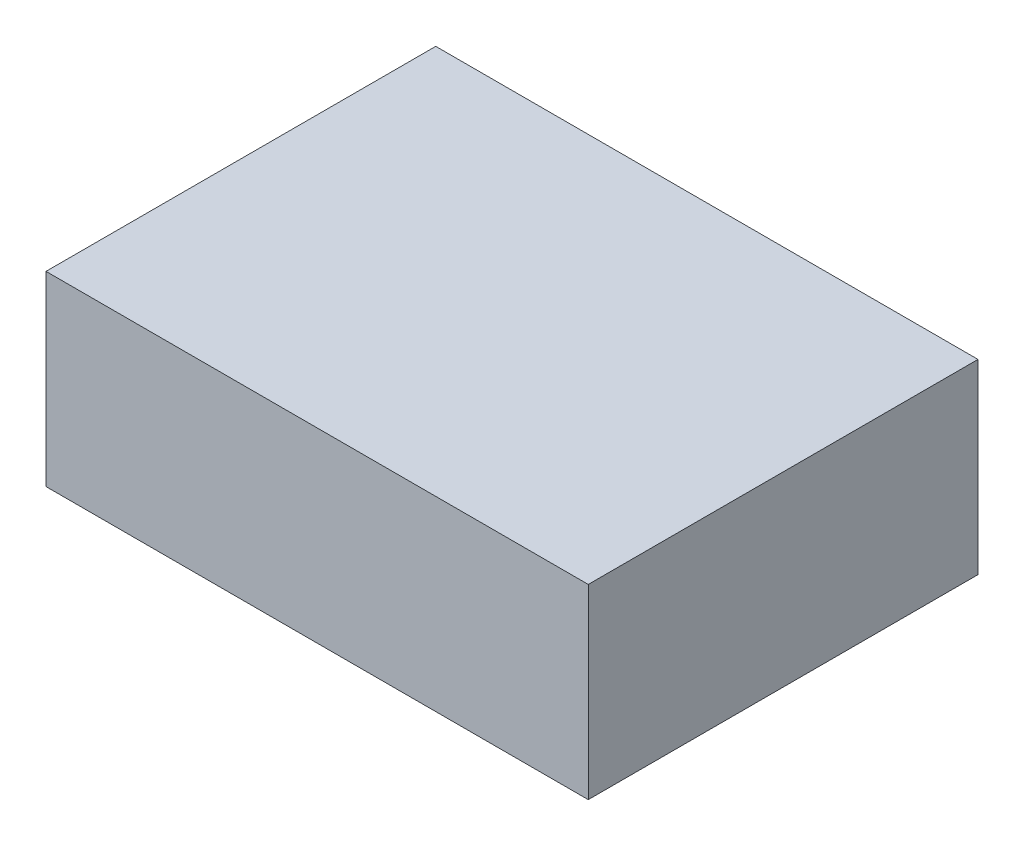
from build123d import *

# Parameters (mm, degrees)
SKETCH_1_W      = 64
SKETCH_1_H      = 46
EXTRUDE_1_DEPTH = 22


with BuildPart() as part:
    # 草图1 → 凸台-拉伸1 (new body)
    with BuildSketch(Plane(origin=(0, 0, 0), x_dir=(1, 0, 0), z_dir=(0, 1, 0))):
        Rectangle(SKETCH_1_W, SKETCH_1_H)
    extrude(amount=EXTRUDE_1_DEPTH)


solid = part.part
